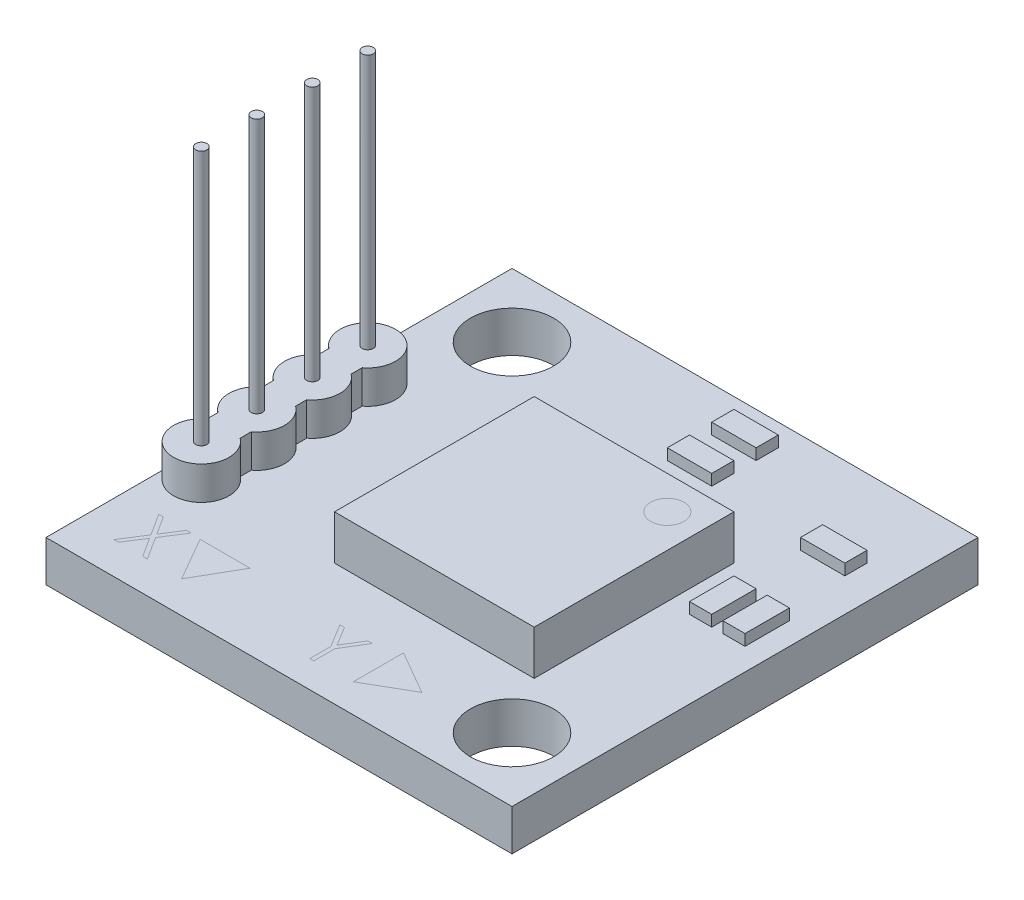
from build123d import *

# Parameters (mm, degrees)
SKETCH1_W                     = 21
SKETCH1_H                     = 21
BOSS_EXTRUDE1_DEPTH           = 1.85
SKETCH2_W                     = 9
SKETCH2_H                     = 9
BOSS_EXTRUDE2_DEPTH           = 2
SKETCH3_R                     = 1.875
CUT_EXTRUDE1_DEPTH            = 1.85
SKETCH4_W                     = 2
SKETCH4_H                     = 1
SKETCH4_W_2                   = 1
SKETCH4_H_2                   = 2
BOSS_EXTRUDE3_DEPTH           = 0.5
SKETCH5_R                     = 0.75
BOSS_EXTRUDE4_DEPTH           = 2
BOSS_EXTRUDE4_DRAFT           = -10
BOSS_EXTRUDE4_PROFILE_2_DEPTH = 2
BOSS_EXTRUDE4_PROFILE_2_DRAFT = -10
BOSS_EXTRUDE4_PROFILE_3_DEPTH = 2
BOSS_EXTRUDE4_PROFILE_3_DRAFT = -10
BOSS_EXTRUDE4_PROFILE_4_DEPTH = 2
BOSS_EXTRUDE4_PROFILE_4_DRAFT = -10
BOSS_EXTRUDE5_DEPTH           = 1.5
SKETCH7_R                     = 0.25
BOSS_EXTRUDE6_DEPTH           = 11.5


with BuildPart() as part:
    # Sketch1 → Boss-Extrude1 (new body)
    with BuildSketch(Plane(origin=(0, 0, 0), x_dir=(1, 0, 0), z_dir=(0, 1, 0))):
        Rectangle(SKETCH1_W, SKETCH1_H)
    extrude(amount=BOSS_EXTRUDE1_DEPTH)

    # Sketch2 → Boss-Extrude2 (add)
    with BuildSketch(Plane(origin=(0, 1.85, 0), x_dir=(1, 0, 0), z_dir=(0, 1, 0))):
        with Locations((1.5, -0.5)):
            Rectangle(SKETCH2_W, SKETCH2_H)
    extrude(amount=BOSS_EXTRUDE2_DEPTH)

    # Sketch3 → Cut-Extrude1 (cut)
    with BuildSketch(Plane(origin=(0, 1.85, 0), x_dir=(1, 0, 0), z_dir=(0, 1, 0))):
        with Locations(Location((7.625, -7.625, 0), (0, 0, 270))):
            Circle(SKETCH3_R)
        with Locations(Location((-7.625, 7.625, 0), (0, 0, 270))):
            Circle(SKETCH3_R)
    extrude(amount=-CUT_EXTRUDE1_DEPTH, mode=Mode.SUBTRACT)

    # Sketch4 → Boss-Extrude3 (add)
    with BuildSketch(Plane(origin=(0, 1.85, 0), x_dir=(1, 0, 0), z_dir=(0, 1, 0))):
        with Locations((1.5, 9)):
            Rectangle(SKETCH4_W, SKETCH4_H)
        with Locations((1.5, 7)):
            Rectangle(SKETCH4_W, SKETCH4_H)
        with Locations((8, 6.5)):
            Rectangle(SKETCH4_W, SKETCH4_H)
        with Locations((7.5, 2)):
            Rectangle(SKETCH4_W_2, SKETCH4_H_2)
        with Locations((9, 2)):
            Rectangle(SKETCH4_W_2, SKETCH4_H_2)
    extrude(amount=BOSS_EXTRUDE3_DEPTH)


with BuildPart() as boss_extrude4_tool:
    # Sketch5 → Boss-Extrude4 (with draft: the straight prism first)
    with BuildSketch(Plane(origin=(0, 0, 0), x_dir=(1, 0, 0), z_dir=(0, 1, 0))):
        with Locations((-9.25, 2.75)):
            Circle(SKETCH5_R)
    extrude(amount=-BOSS_EXTRUDE4_DEPTH)
    # Boss-Extrude4: the draft: its side faces are tilted about the plane it starts from
    boss_extrude4_sides = [boss_extrude4_tool.faces().sort_by_distance(p)[0] for p in [
        (-10, -1, -2.75),
    ]]
    draft(boss_extrude4_sides, Plane(origin=(0, 0, 0), x_dir=(1, 0, 0), z_dir=(0, 1, 0)), BOSS_EXTRUDE4_DRAFT)


with BuildPart() as part_1:
    add(part.part)

    # Boss-Extrude4: add boss_extrude4_tool
    add(boss_extrude4_tool.part)


with BuildPart() as boss_extrude4_profile_2_tool:
    # Sketch5 → Boss-Extrude4 profile 2 (with draft: the straight prism first)
    with BuildSketch(Plane(origin=(0, 0, 0), x_dir=(1, 0, 0), z_dir=(0, 1, 0))):
        with Locations((-9.25, 0.25)):
            Circle(SKETCH5_R)
    extrude(amount=-BOSS_EXTRUDE4_PROFILE_2_DEPTH)
    # Boss-Extrude4 profile 2: the draft: its side faces are tilted about the plane it starts from
    boss_extrude4_profile_2_sides = [boss_extrude4_profile_2_tool.faces().sort_by_distance(p)[0] for p in [
        (-10, -1, -0.25),
    ]]
    draft(boss_extrude4_profile_2_sides, Plane(origin=(0, 0, 0), x_dir=(1, 0, 0), z_dir=(0, 1, 0)), BOSS_EXTRUDE4_PROFILE_2_DRAFT)


with BuildPart() as part_2:
    add(part_1.part)

    # Boss-Extrude4 profile 2: add boss_extrude4_profile_2_tool
    add(boss_extrude4_profile_2_tool.part)


with BuildPart() as boss_extrude4_profile_3_tool:
    # Sketch5 → Boss-Extrude4 profile 3 (with draft: the straight prism first)
    with BuildSketch(Plane(origin=(0, 0, 0), x_dir=(1, 0, 0), z_dir=(0, 1, 0))):
        with Locations((-9.25, -2.25)):
            Circle(SKETCH5_R)
    extrude(amount=-BOSS_EXTRUDE4_PROFILE_3_DEPTH)
    # Boss-Extrude4 profile 3: the draft: its side faces are tilted about the plane it starts from
    boss_extrude4_profile_3_sides = [boss_extrude4_profile_3_tool.faces().sort_by_distance(p)[0] for p in [
        (-10, -1, 2.25),
    ]]
    draft(boss_extrude4_profile_3_sides, Plane(origin=(0, 0, 0), x_dir=(1, 0, 0), z_dir=(0, 1, 0)), BOSS_EXTRUDE4_PROFILE_3_DRAFT)


with BuildPart() as part_3:
    add(part_2.part)

    # Boss-Extrude4 profile 3: add boss_extrude4_profile_3_tool
    add(boss_extrude4_profile_3_tool.part)


with BuildPart() as boss_extrude4_profile_4_tool:
    # Sketch5 → Boss-Extrude4 profile 4 (with draft: the straight prism first)
    with BuildSketch(Plane(origin=(0, 0, 0), x_dir=(1, 0, 0), z_dir=(0, 1, 0))):
        with Locations((-9.25, -4.75)):
            Circle(SKETCH5_R)
    extrude(amount=-BOSS_EXTRUDE4_PROFILE_4_DEPTH)
    # Boss-Extrude4 profile 4: the draft: its side faces are tilted about the plane it starts from
    boss_extrude4_profile_4_sides = [boss_extrude4_profile_4_tool.faces().sort_by_distance(p)[0] for p in [
        (-10, -1, 4.75),
    ]]
    draft(boss_extrude4_profile_4_sides, Plane(origin=(0, 0, 0), x_dir=(1, 0, 0), z_dir=(0, 1, 0)), BOSS_EXTRUDE4_PROFILE_4_DRAFT)


with BuildPart() as part_4:
    add(part_3.part)

    # Boss-Extrude4 profile 4: add boss_extrude4_profile_4_tool
    add(boss_extrude4_profile_4_tool.part)

    # Sketch6 → Boss-Extrude5 (add)
    with BuildSketch(Plane.XZ.offset(-1.85)):
        with BuildLine():
            Line((-10, -1.25), (-10, -1.75))
            ThreePointArc((-10, -1.75), (-9.25, -4), (-8.5, -1.75))
            Line((-8.5, -1.75), (-8.5, -1.25))
            ThreePointArc((-8.5, -1.25), (-8, -0.25), (-8.5, 0.75))
            Line((-8.5, 0.75), (-8.5, 1.25))
            ThreePointArc((-8.5, 1.25), (-8, 2.25), (-8.5, 3.25))
            Line((-8.5, 3.25), (-8.5, 3.75))
            ThreePointArc((-8.5, 3.75), (-9.25, 6), (-10, 3.75))
            Line((-10, 3.75), (-10, 3.25))
            ThreePointArc((-10, 3.25), (-10.5, 2.25), (-10, 1.25))
            Line((-10, 1.25), (-10, 0.75))
            ThreePointArc((-10, 0.75), (-10.5, -0.25), (-10, -1.25))
        make_face()
    extrude(amount=-BOSS_EXTRUDE5_DEPTH)

    # Sketch7 → Boss-Extrude6 (add)
    with BuildSketch(Plane(origin=(0, 3.35, 0), x_dir=(-1, 0, 0), z_dir=(0, 1, 0))):
        with Locations(Location((9.25, -2.75, 0), (0, 0, 270))):
            Circle(SKETCH7_R)
        with Locations(Location((9.25, -0.25, 0), (0, 0, 270))):
            Circle(SKETCH7_R)
        with Locations(Location((9.25, 2.25, 0), (0, 0, 270))):
            Circle(SKETCH7_R)
        with Locations(Location((9.25, 4.75, 0), (0, 0, 270))):
            Circle(SKETCH7_R)
    extrude(amount=BOSS_EXTRUDE6_DEPTH)


solid = part_4.part
